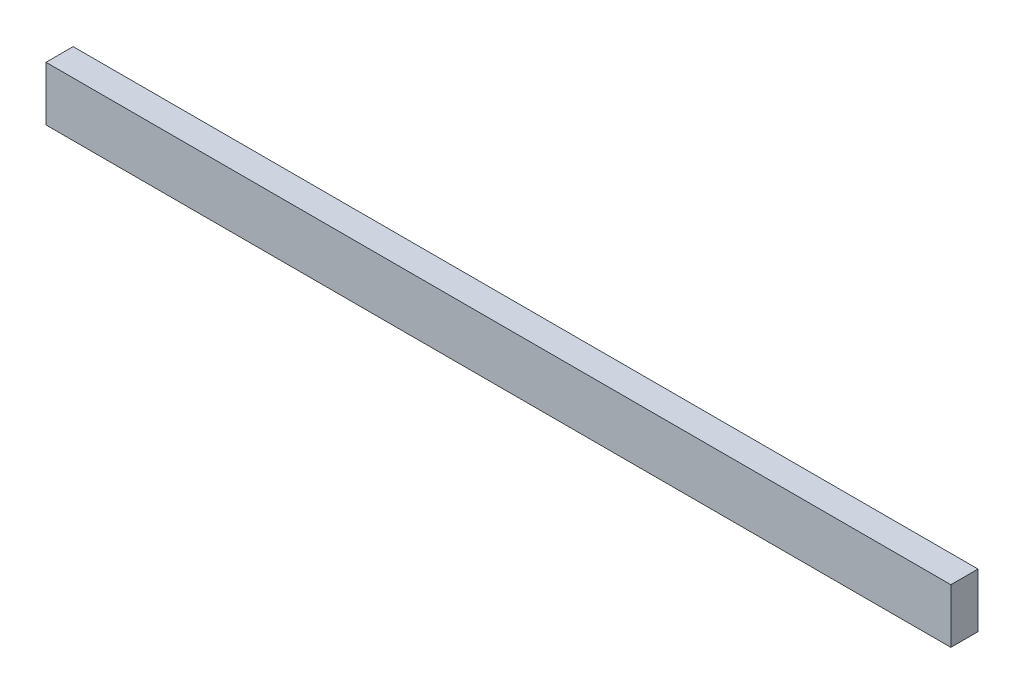
from build123d import *

# Parameters (mm, degrees)
SKETCH1_W           = 100
SKETCH1_H           = 6
BOSS_EXTRUDE1_DEPTH = 3


with BuildPart() as part:
    # Sketch1 → Boss-Extrude1 (new body)
    with BuildSketch(Plane.XY):
        Rectangle(SKETCH1_W, SKETCH1_H)
    extrude(amount=BOSS_EXTRUDE1_DEPTH)


solid = part.part
